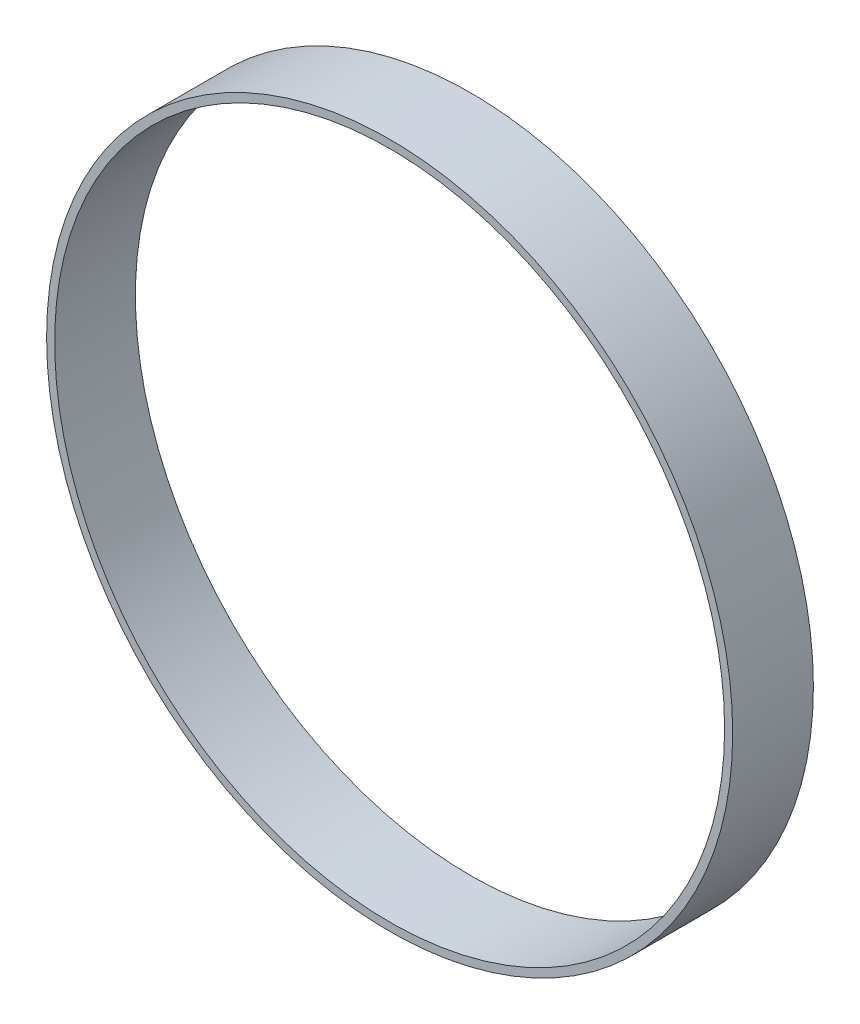
from build123d import *

# Parameters (mm, degrees)
SKETCH1_R           = 85
SKETCH1_R_2         = 83
BOSS_EXTRUDE1_DEPTH = 20


with BuildPart() as part:
    # Sketch1 → Boss-Extrude1 (new body)
    with BuildSketch(Plane.XY):
        Circle(SKETCH1_R)
        Circle(SKETCH1_R_2, mode=Mode.SUBTRACT)
    extrude(amount=BOSS_EXTRUDE1_DEPTH)


solid = part.part
